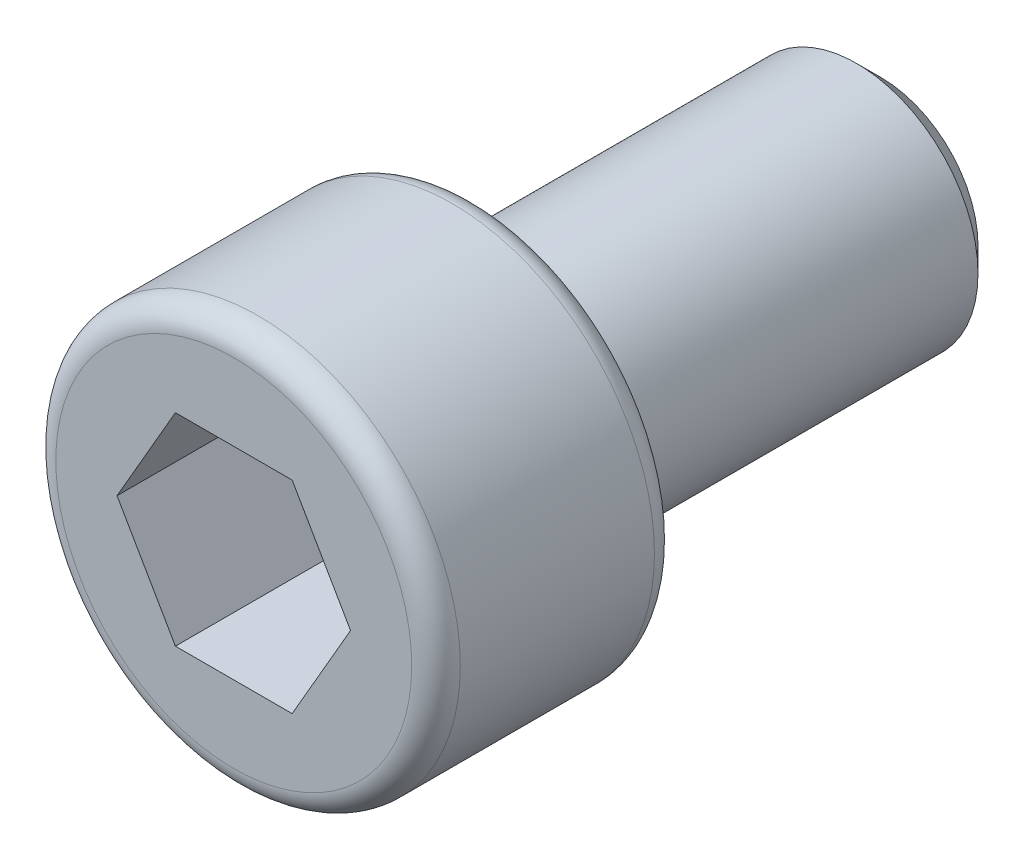
from build123d import *

# Parameters (mm, degrees)
SKETCH_1_R          = 2.5
EXTRUDE_1_DEPTH     = 3
SKETCH_2_R          = 1.5
EXTRUDE_2_DEPTH     = 5
CUT_EXTRUDE_1_DEPTH = 2
CHAMFER_1_SIZE      = 0.3
FILLET_1_R          = 0.3


with BuildPart() as part:
    # 草图1 → 凸台-拉伸1 (new body)
    with BuildSketch(Plane.XY):
        Circle(SKETCH_1_R)
    extrude(amount=EXTRUDE_1_DEPTH)

    # 草图2 → 凸台-拉伸2 (add)
    with BuildSketch(Plane(origin=(0, 0, 0), x_dir=(-1, 0, 0), z_dir=(0, 0, -1))):
        Circle(SKETCH_2_R)
    extrude(amount=EXTRUDE_2_DEPTH)

    # 草图3 → 切除-拉伸1 (cut)
    with BuildSketch(Plane.XY.offset(3)):
        Polygon((1.443375673, 0), (0.721687836, 1.25), (-0.721687836, 1.25), (-1.443375673, 0), (-0.721687836, -1.25), (0.721687836, -1.25), align=None)
    extrude(amount=-CUT_EXTRUDE_1_DEPTH, mode=Mode.SUBTRACT)

    # 倒角1
    chamfer_1_edges = [part.edges().sort_by_distance(p)[0] for p in [
        (1.5, 0, -5),
    ]]
    chamfer(chamfer_1_edges, length=CHAMFER_1_SIZE)

    # 圆角1
    fillet_1_edges = [part.edges().sort_by_distance(p)[0] for p in [
        (-2.5, 0, 0),
        (-2.5, 0, 3),
    ]]
    fillet(fillet_1_edges, radius=FILLET_1_R)


solid = part.part
